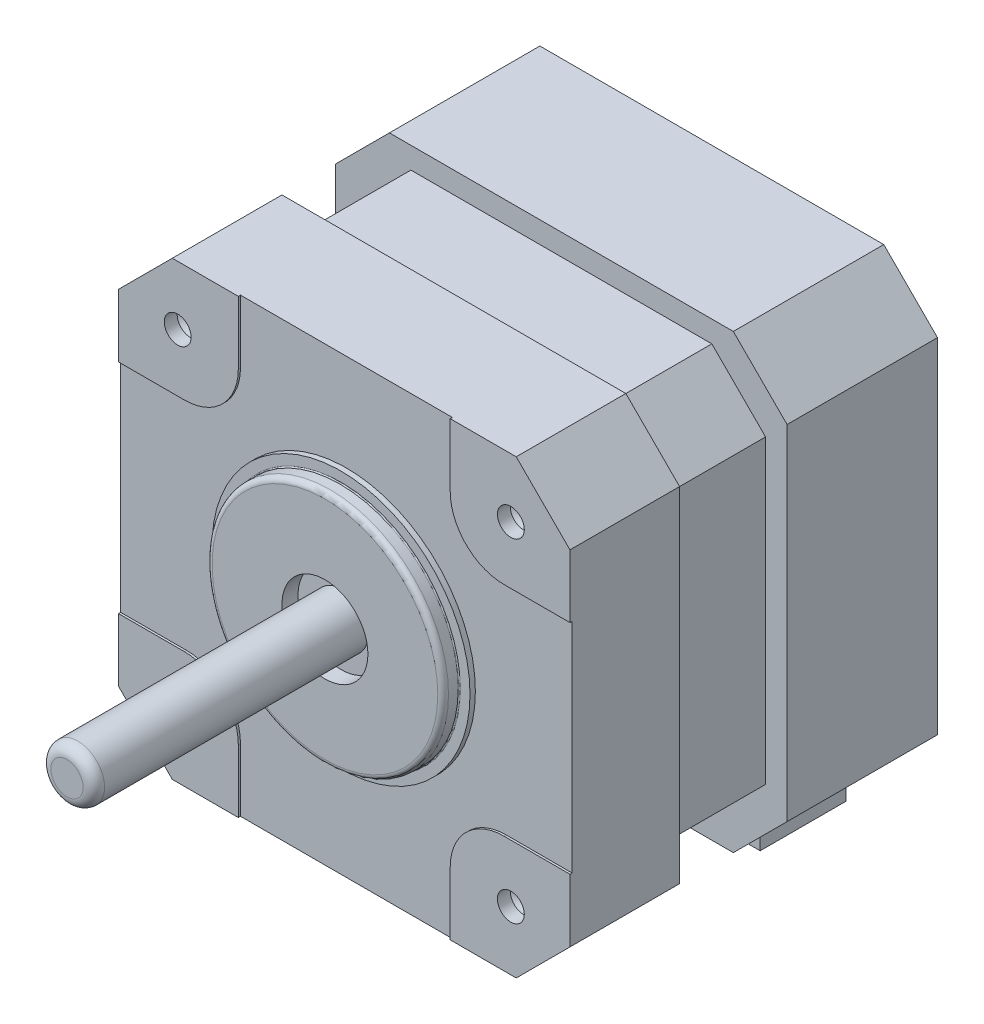
from build123d import *

# Parameters (mm, degrees)
SKETCH1_W             = 42
SKETCH1_H             = 42
BOSS_EXTRUDE1_DEPTH   = 36
SKETCH2_OUTSIDE_W     = 57.892
SKETCH2_OUTSIDE_H     = 57.892
SKETCH2_OUTSIDE_R     = 11
CUT_EXTRUDE1_DEPTH    = 2
FILLET1_R             = 0.5
SKETCH3_R             = 4
CUT_EXTRUDE2_DEPTH    = 3
SKETCH4_R             = 2.5
BOSS_EXTRUDE2_DEPTH   = 27
FILLET3_R             = 1
SKETCH5_R             = 12
BOSS_EXTRUDE3_DEPTH   = 0.5
FILLET4_R             = 0.1
M3_TAPPED_HOLE1_D     = 2.5
M3_TAPPED_HOLE1_DEPTH = 1
M3_TAPPED_HOLE1_TIP   = 0.751075774
CHAMFER2_SIZE         = 5
BOSS_EXTRUDE4_DEPTH   = 0.2
CUT_EXTRUDE4_START    = -10
CUT_EXTRUDE4_DEPTH    = 10
BOSS_EXTRUDE5_START   = -34.2
BOSS_EXTRUDE5_DEPTH   = 8
M3_TAPPED_HOLE3_D     = 2.5
M3_TAPPED_HOLE3_DEPTH = 1
M3_TAPPED_HOLE3_TIP   = 0.751075774


with BuildPart() as part:
    # Sketch1 → Boss-Extrude1 (new body)
    with BuildSketch(Plane.XY):
        Rectangle(SKETCH1_W, SKETCH1_H)
    extrude(amount=BOSS_EXTRUDE1_DEPTH)

    # Sketch2 outside → Cut-Extrude1 (cut)
    with BuildSketch(Plane.XY.offset(36)):
        Rectangle(SKETCH2_OUTSIDE_W, SKETCH2_OUTSIDE_H)
        Circle(SKETCH2_OUTSIDE_R, mode=Mode.SUBTRACT)
    extrude(amount=-CUT_EXTRUDE1_DEPTH, mode=Mode.SUBTRACT)

    # Fillet1
    fillet1_edges = [part.edges().sort_by_distance(p)[0] for p in [
        (-11, 0, 36),
    ]]
    fillet(fillet1_edges, radius=FILLET1_R)

    # Sketch3 → Cut-Extrude2 (cut)
    with BuildSketch(Plane.XY.offset(36)):
        Circle(SKETCH3_R)
    extrude(amount=-CUT_EXTRUDE2_DEPTH, mode=Mode.SUBTRACT)

    # Sketch4 → Boss-Extrude2 (add)
    with BuildSketch(Plane.XY.offset(33)):
        Circle(SKETCH4_R)
    extrude(amount=BOSS_EXTRUDE2_DEPTH)

    # Fillet3
    fillet3_edges = [part.edges().sort_by_distance(p)[0] for p in [
        (-2.5, 0, 60),
    ]]
    fillet(fillet3_edges, radius=FILLET3_R)

    # Sketch5 → Boss-Extrude3 (add)
    with BuildSketch(Plane.XY.offset(34)):
        Circle(SKETCH5_R)
    extrude(amount=BOSS_EXTRUDE3_DEPTH)

    # Fillet4
    fillet4_edges = [part.edges().sort_by_distance(p)[0] for p in [
        (-11, 0, 34.5),
    ]]
    fillet(fillet4_edges, radius=FILLET4_R)

    # M3 Tapped Hole1
    with Locations(Plane.XY.offset(34)):
        with Locations((15.5, 15.5), (-15.5, 15.5), (15.5, -15.5), (-15.5, -15.5)):
            Hole(M3_TAPPED_HOLE1_D / 2, depth=M3_TAPPED_HOLE1_DEPTH)
            with Locations((0, 0, -(M3_TAPPED_HOLE1_DEPTH + M3_TAPPED_HOLE1_TIP / 2))):  # 118° drill point
                Cone(0, M3_TAPPED_HOLE1_D / 2, M3_TAPPED_HOLE1_TIP, mode=Mode.SUBTRACT)

    # Chamfer2
    chamfer2_edges = [part.edges().sort_by_distance(p)[0] for p in [
        (21, -21, 17),
        (-21, -21, 17),
        (-21, 21, 17),
        (21, 21, 17),
    ]]
    chamfer(chamfer2_edges, length=CHAMFER2_SIZE)

    # Sketch9 → Boss-Extrude4 (add)
    with BuildSketch(Plane.XY.offset(34)):
        with BuildLine():
            Line((16, 21), (21, 16))
            Line((21, 16), (21, 10.138100447))
            Line((21, 10.138100447), (14.858342654, 10.138100447))
            ThreePointArc((14.858342654, 10.138100447), (11.322808748, 11.602566541), (9.858342654, 15.138100447))
            Line((9.858342654, 15.138100447), (9.858342654, 21))
            Line((9.858342654, 21), (16, 21))
        make_face()
        with BuildLine():
            Line((-21, 10.138100447), (-21, 16))
            Line((-21, 16), (-16, 21))
            Line((-16, 21), (-9.858342654, 21))
            Line((-9.858342654, 21), (-9.858342654, 15.138100447))
            ThreePointArc((-9.858342654, 15.138100447), (-11.322808748, 11.602566541), (-14.858342654, 10.138100447))
            Line((-14.858342654, 10.138100447), (-21, 10.138100447))
        make_face()
        with BuildLine():
            Line((-16, -21), (-21, -16))
            Line((-21, -16), (-21, -10.138100447))
            Line((-21, -10.138100447), (-14.858342654, -10.138100447))
            ThreePointArc((-14.858342654, -10.138100447), (-11.322808748, -11.602566541), (-9.858342654, -15.138100447))
            Line((-9.858342654, -15.138100447), (-9.858342654, -21))
            Line((-9.858342654, -21), (-16, -21))
        make_face()
        with BuildLine():
            Line((21, -10.138100447), (21, -16))
            Line((21, -16), (16, -21))
            Line((16, -21), (9.858342654, -21))
            Line((9.858342654, -21), (9.858342654, -15.138100447))
            ThreePointArc((9.858342654, -15.138100447), (11.322808748, -11.602566541), (14.858342654, -10.138100447))
            Line((14.858342654, -10.138100447), (21, -10.138100447))
        make_face()
    extrude(amount=BOSS_EXTRUDE4_DEPTH)

    # Sketch10 → Cut-Extrude4 (cut)
    with BuildSketch(Plane.XY.offset(34).offset(CUT_EXTRUDE4_START)):
        Polygon((21, 16.017915508), (16.017915508, 21), (-15.980285858, 21.03762965), (-21, 16.017915508), (-21, -16.050170564), (-16.050170564, -21), (16.010758898, -21), (21, -16.010758898), align=None)
        Polygon((19, -14), (14, -19), (-14, -19), (-19, -14), (-19, 14), (-14, 19), (14, 19), (19, 14), align=None, mode=Mode.SUBTRACT)
    extrude(amount=-CUT_EXTRUDE4_DEPTH, mode=Mode.SUBTRACT)

    # Sketch13 → Boss-Extrude5 (add)
    with BuildSketch(Plane.XY.offset(34.2).offset(BOSS_EXTRUDE5_START)):
        Polygon((-12.5, -25.6), (12.5, -25.6), (12.5, -23.3), (13.7, -23.3), (16, -21), (12.5, -21), (-12.5, -21), (-16, -21), (-13.7, -23.3), (-12.5, -23.3), align=None)
    extrude(amount=BOSS_EXTRUDE5_DEPTH)

    # M3 Tapped Hole3
    with Locations(Plane.XY.offset(34.2)):
        with Locations((-15.5, 15.5), (15.5, 15.5), (15.5, -15.5), (-15.5, -15.5)):
            Hole(M3_TAPPED_HOLE3_D / 2, depth=M3_TAPPED_HOLE3_DEPTH)
            with Locations((0, 0, -(M3_TAPPED_HOLE3_DEPTH + M3_TAPPED_HOLE3_TIP / 2))):  # 118° drill point
                Cone(0, M3_TAPPED_HOLE3_D / 2, M3_TAPPED_HOLE3_TIP, mode=Mode.SUBTRACT)


solid = part.part
